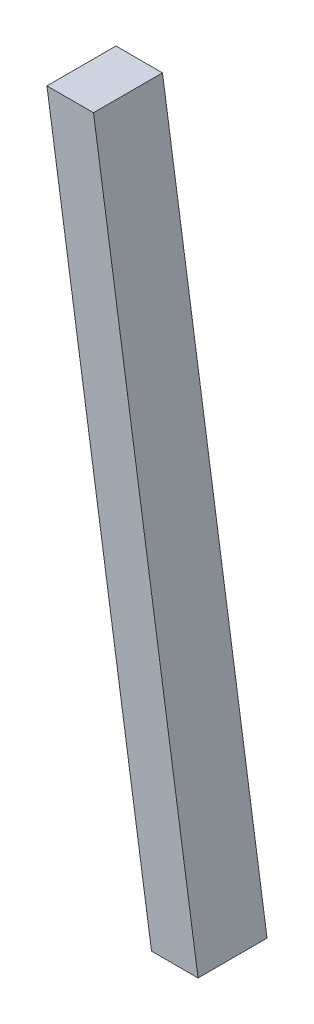
from build123d import *

# Parameters (mm, degrees)
EXTRUDE_4_DEPTH = 60


with BuildPart() as part:
    # 草圖1 → 填料-伸長4 (new body)
    with BuildSketch(Plane.XY):
        Polygon((42.432503168, 0), (24.252503168, 0), (30.252503168, -40), (115.152503168, -606), (155.6, -606), (64.7, 0), (44.476251584, 0), align=None)
    extrude(amount=EXTRUDE_4_DEPTH)


solid = part.part
